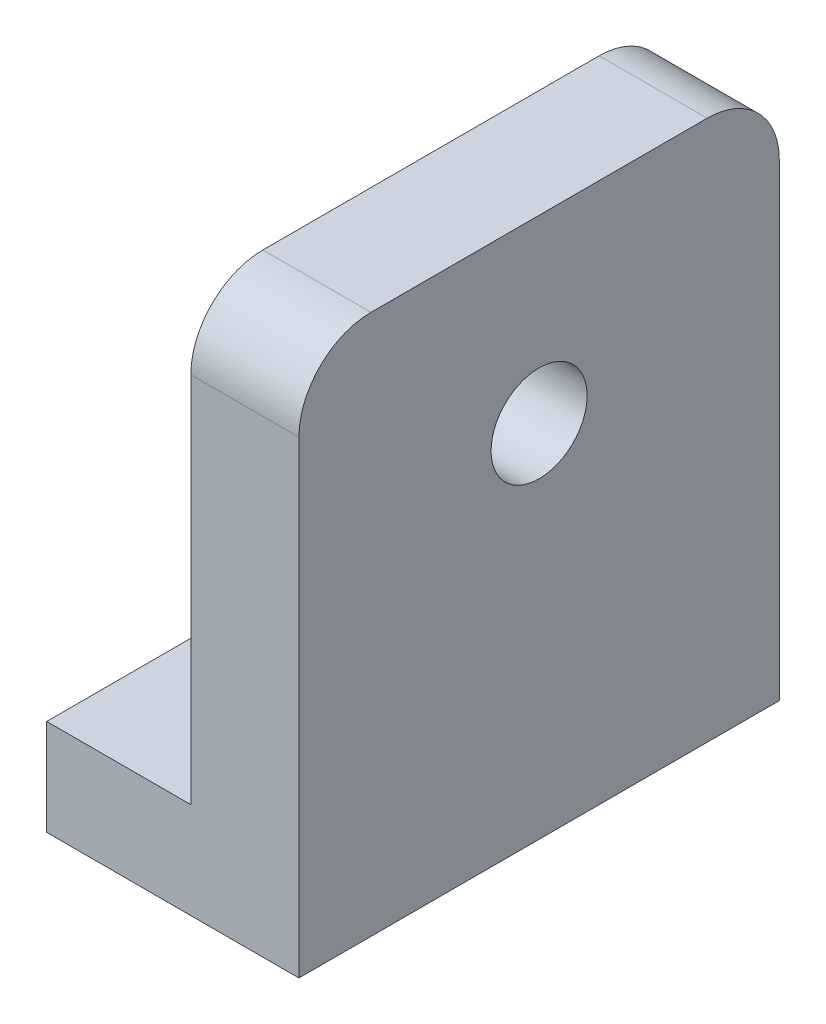
from build123d import *

# Parameters (mm, degrees)
EXTRUDE_1_DEPTH     = 40
FILLET_1_R          = 6
SKETCH_2_R          = 4
CUT_EXTRUDE_1_DEPTH = 62.392181913


with BuildPart() as part:
    # 草图1 → 凸台-拉伸1 (new body)
    with BuildSketch(Plane.XY):
        Polygon((0, 0), (-21, 0), (-21, 8), (-9, 8), (-9, 45), (0, 45), align=None)
    extrude(amount=EXTRUDE_1_DEPTH)

    # 圆角1
    fillet_1_edges = [part.edges().sort_by_distance(p)[0] for p in [
        (-4.5, 45, 40),
        (-4.5, 45, 0),
    ]]
    fillet(fillet_1_edges, radius=FILLET_1_R)

    # 草图2 → 切除-拉伸1 (cut, through all)
    with BuildSketch(Plane.ZY.offset(9)):
        with Locations((20, 30)):
            Circle(SKETCH_2_R)
    extrude(amount=-CUT_EXTRUDE_1_DEPTH, mode=Mode.SUBTRACT)


solid = part.part
